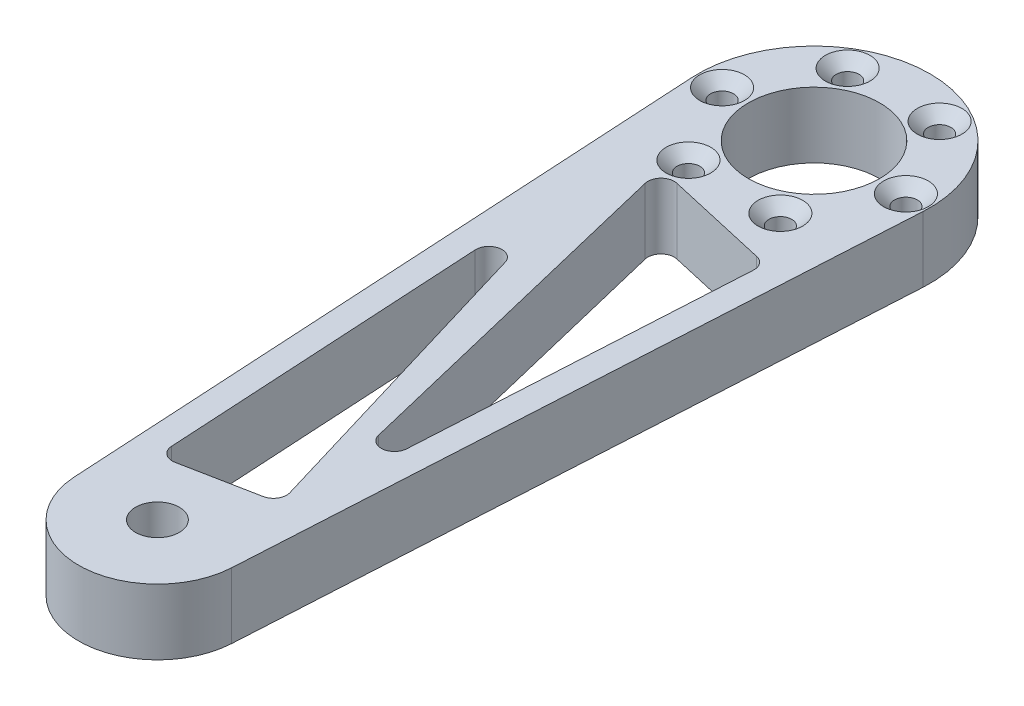
from build123d import *

# Parameters (mm, degrees)
SKETCH_1_R               = 5
SKETCH_1_R_2             = 15
EXTRUDE_1_DEPTH          = 15
FILLET_1_R               = 3
SKETCH_2_R               = 2.6
CUT_EXTRUDE_1_DEPTH      = 180.107509614
PATTERN_CIRCULAR_5_COUNT = 3
CHAMFER_1_SIZE           = 2.5


with BuildPart() as part:
    # 草图1 → 凸台-拉伸1 (new body)
    with BuildSketch(Plane(origin=(0, 0, 0), x_dir=(1, 0, 0), z_dir=(0, 1, 0))):
        with BuildLine():
            Line((-17.971076762, -1.02), (-26.457418567, 148.498333333))
            ThreePointArc((-26.457418567, 148.498333333), (0, 176.5), (26.457418567, 148.498333333))
            Line((26.457418567, 148.498333333), (17.971076762, -1.02))
            ThreePointArc((17.971076762, -1.02), (0, -18), (-17.971076762, -1.02))
        make_face()
        with Locations(Location((0, 0, 0), (0, 0, 270))):
            Circle(SKETCH_1_R, mode=Mode.SUBTRACT)
        with Locations(Location((0, 150, 0), (0, 0, 270))):
            Circle(SKETCH_1_R_2, mode=Mode.SUBTRACT)
        Polygon((-12.740980954, 12.714849757), (-18.554385191, 115.139490738), (10.712851955, 17.329399023), align=None, mode=Mode.SUBTRACT)
        Polygon((13.283215706, 22.268322657), (18.830257334, 120), (-12, 127), align=None, mode=Mode.SUBTRACT)
    extrude(amount=EXTRUDE_1_DEPTH)

    # 圆角1
    fillet_1_edges = [part.edges().sort_by_distance(p)[0] for p in [
        (-12.740980954, 7.5, -12.714849757),
        (10.712851955, 7.5, -17.329399023),
        (-18.554385191, 7.5, -115.139490738),
        (18.830257334, 7.5, -120),
        (-12, 7.5, -127),
        (13.283215706, 7.5, -22.268322657),
    ]]
    fillet(fillet_1_edges, radius=FILLET_1_R)

    # 草图2 → 切除-拉伸1 (cut, through all)
    with BuildSketch(Plane(origin=(0, 15, 0), x_dir=(1, 0, 0), z_dir=(0, 1, 0))):
        with Locations(Location((-21, 150, 0), (0, 0, 270))):
            Circle(SKETCH_2_R)
        with Locations(Location((21, 150, 0), (0, 0, 270))):
            Circle(SKETCH_2_R)
    cut_extrude_1 = extrude(amount=-CUT_EXTRUDE_1_DEPTH, mode=Mode.SUBTRACT)

    # 阵列(圆周)5: 切除-拉伸1 ×3 about axis
    pattern_circular_5_axis = Axis((0, 0, -150), (0, 1, 0))
    for i in range(1, PATTERN_CIRCULAR_5_COUNT):
        add(cut_extrude_1.rotate(pattern_circular_5_axis, i * 360 / PATTERN_CIRCULAR_5_COUNT), mode=Mode.SUBTRACT)

    # 倒角1
    chamfer_1_edges = [part.edges().sort_by_distance(p)[0] for p in [
        (-12.75166605, 15, -166.886533479),
        (-8.24833395, 15, -130.513466521),
        (-21, 15, -152.6),
        (21, 15, -152.6),
        (8.24833395, 15, -130.513466521),
        (12.75166605, 15, -166.886533479),
    ]]
    chamfer(chamfer_1_edges, length=CHAMFER_1_SIZE)


solid = part.part
